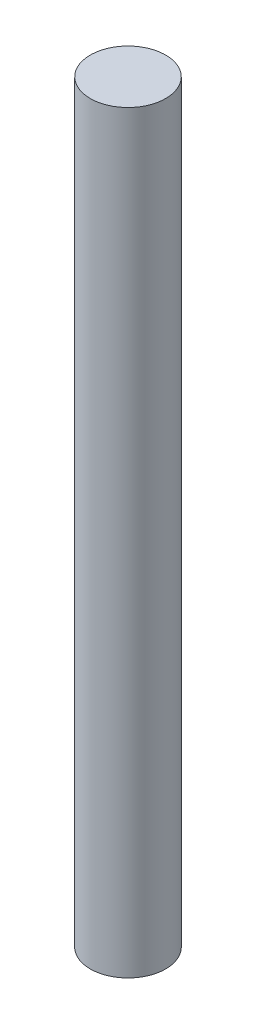
from build123d import *

# Parameters (mm, degrees)
SKETCH_1_R      = 10
EXTRUDE_1_DEPTH = 200


with BuildPart() as part:
    # Эскиз1 → Бобышка-Вытянуть1 (new body)
    with BuildSketch(Plane(origin=(0, 0, 0), x_dir=(1, 0, 0), z_dir=(0, 1, 0))):
        with Locations(Location((0, 0, 0), (0, 0, 270))):
            Circle(SKETCH_1_R)
    extrude(amount=EXTRUDE_1_DEPTH)


solid = part.part
